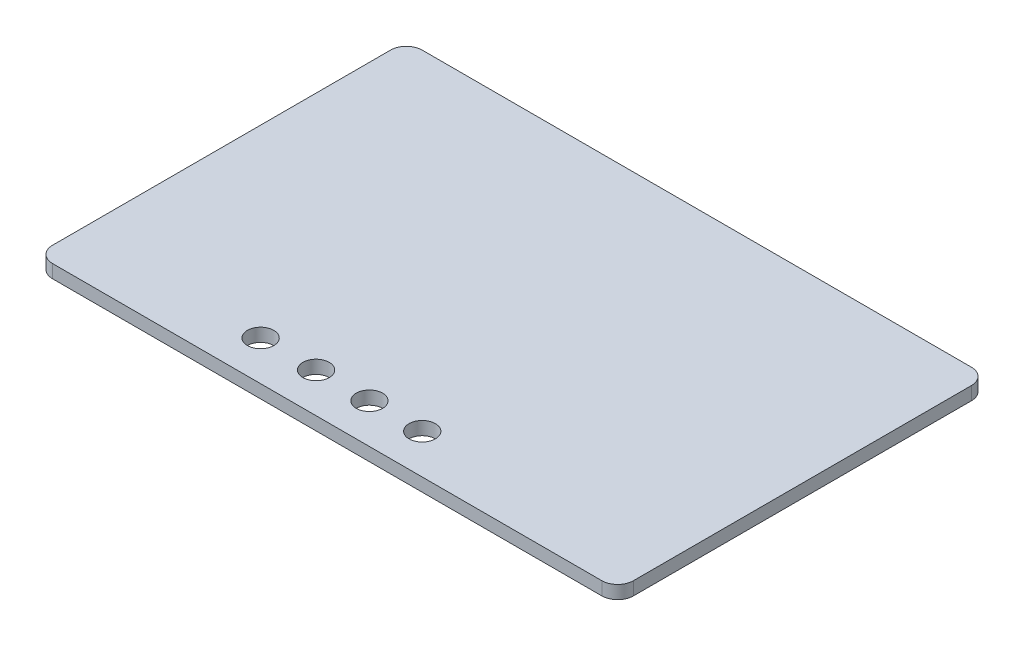
from build123d import *

# Parameters (mm, degrees)
BOSS_EXTRUDE1_DEPTH  = 2.5
BOSS_EXTRUDE6_DEPTH  = 24.5
CUT_EXTRUDE7_REACH   = 72.562
SKETCH3_R            = 2.5
BOSS_EXTRUDE11_START = -24.5
SKETCH12_R           = 1.4
BOSS_EXTRUDE11_DEPTH = 20
CUT_EXTRUDE11_REACH  = 120.55
SKETCH13_R           = 6.15
BOSS_EXTRUDE13_START = -4.5
SKETCH12_5_R         = 1.4
BOSS_EXTRUDE13_DEPTH = 2
CUT_EXTRUDE12_START  = -24.5
CUT_EXTRUDE12_DEPTH  = 24.5
BOSS_EXTRUDE14_START = -24.5
SKETCH12_6_R         = 1.4
BOSS_EXTRUDE14_DEPTH = 5


with BuildPart() as part:
    # Sketch1 → Boss-Extrude1 (new body)
    with BuildSketch(Plane(origin=(0, 0, 0), x_dir=(1, 0, 0), z_dir=(0, 1, 0))):
        with BuildLine():
            Line((-52, -35), (52, -35))
            ThreePointArc((52, -35), (54.121320344, -34.121320344), (55, -32))
            Line((55, -32), (55, 32))
            ThreePointArc((55, 32), (54.121320344, 34.121320344), (52, 35))
            Line((52, 35), (-52, 35))
            ThreePointArc((-52, 35), (-54.121320344, 34.121320344), (-55, 32))
            Line((-55, 32), (-55, -32))
            ThreePointArc((-55, -32), (-54.121320344, -34.121320344), (-52, -35))
        make_face()
    extrude(amount=-BOSS_EXTRUDE1_DEPTH)

    # Sketch7 → Boss-Extrude6 (add)
    with BuildSketch(Plane.XZ.offset(2.5)):
        with BuildLine():
            Line((-55, 32), (-55, -32))
            ThreePointArc((-55, -32), (-54.121320344, -34.121320344), (-52, -35))
            Line((-52, -35), (52, -35))
            ThreePointArc((52, -35), (54.121320344, -34.121320344), (55, -32))
            Line((55, -32), (55, 32))
            ThreePointArc((55, 32), (54.121320344, 34.121320344), (52, 35))
            Line((52, 35), (-52, 35))
            ThreePointArc((-52, 35), (-54.121320344, 34.121320344), (-55, 32))
        make_face()
        with BuildLine():
            Line((-53.5, 32), (-53.5, -32))
            ThreePointArc((-53.5, -32), (-53.060660172, -33.060660172), (-52, -33.5))
            Line((-52, -33.5), (52, -33.5))
            ThreePointArc((52, -33.5), (53.060660172, -33.060660172), (53.5, -32))
            Line((53.5, -32), (53.5, 32))
            ThreePointArc((53.5, 32), (53.060660172, 33.060660172), (52, 33.5))
            Line((52, 33.5), (-52, 33.5))
            ThreePointArc((-52, 33.5), (-53.060660172, 33.060660172), (-53.5, 32))
        make_face(mode=Mode.SUBTRACT)
    extrude(amount=BOSS_EXTRUDE6_DEPTH)

    # Sketch3 → Cut-Extrude7 (cut, up to next)
    with BuildSketch(Plane(origin=(0, 0, 0), x_dir=(1, 0, 0), z_dir=(0, 1, 0)), mode=Mode.PRIVATE) as cut_extrude7_sk1:
        with Locations(Location((-20.1, -27.5, 0), (0, 0, 270))):
            Circle(SKETCH3_R)
    cut_extrude7_tool1 = extrude(cut_extrude7_sk1.sketch, amount=-CUT_EXTRUDE7_REACH, mode=Mode.PRIVATE) & part.part
    # Sketch3 → Cut-Extrude7 (cut, up to next)
    with BuildSketch(Plane(origin=(0, 0, 0), x_dir=(1, 0, 0), z_dir=(0, 1, 0)), mode=Mode.PRIVATE) as cut_extrude7_sk2:
        with Locations(Location((-9.6, -27.5, 0), (0, 0, 270))):
            Circle(SKETCH3_R)
    cut_extrude7_tool2 = extrude(cut_extrude7_sk2.sketch, amount=-CUT_EXTRUDE7_REACH, mode=Mode.PRIVATE) & part.part
    # Sketch3 → Cut-Extrude7 (cut, up to next)
    with BuildSketch(Plane(origin=(0, 0, 0), x_dir=(1, 0, 0), z_dir=(0, 1, 0)), mode=Mode.PRIVATE) as cut_extrude7_sk3:
        with Locations(Location((0.5, -27.5, 0), (0, 0, 270))):
            Circle(SKETCH3_R)
    cut_extrude7_tool3 = extrude(cut_extrude7_sk3.sketch, amount=-CUT_EXTRUDE7_REACH, mode=Mode.PRIVATE) & part.part
    # Sketch3 → Cut-Extrude7 (cut, up to next)
    with BuildSketch(Plane(origin=(0, 0, 0), x_dir=(1, 0, 0), z_dir=(0, 1, 0)), mode=Mode.PRIVATE) as cut_extrude7_sk4:
        with Locations(Location((10.5, -27.5, 0), (0, 0, 270))):
            Circle(SKETCH3_R)
    cut_extrude7_tool4 = extrude(cut_extrude7_sk4.sketch, amount=-CUT_EXTRUDE7_REACH, mode=Mode.PRIVATE) & part.part
    add(cut_extrude7_tool1.solids().sort_by_distance((-20.1, 0, 27.5))[0], mode=Mode.SUBTRACT)
    add(cut_extrude7_tool2.solids().sort_by_distance((-9.6, 0, 27.5))[0], mode=Mode.SUBTRACT)
    add(cut_extrude7_tool3.solids().sort_by_distance((0.5, 0, 27.5))[0], mode=Mode.SUBTRACT)
    add(cut_extrude7_tool4.solids().sort_by_distance((10.5, 0, 27.5))[0], mode=Mode.SUBTRACT)

    # Sketch12 → Boss-Extrude11 (add)
    # profile 1 of 6: a face of its own
    with BuildSketch(Plane.XZ.offset(27).offset(BOSS_EXTRUDE11_START)):
        with BuildLine():
            Line((-39.5, 27.5), (-39.5, 33.5))
            Line((-39.5, 33.5), (-52, 33.5))
            ThreePointArc((-52, 33.5), (-53.060660172, 33.060660172), (-53.5, 32))
            Line((-53.5, 32), (-53.5, 22.5))
            Line((-53.5, 22.5), (-44.5, 22.5))
            ThreePointArc((-44.5, 22.5), (-40.964466094, 23.964466094), (-39.5, 27.5))
        make_face()
        with Locations(Location((-45.5, 27.5, 0), (0, 0, 270))):
            Circle(SKETCH12_R, mode=Mode.SUBTRACT)
    # profile 2 of 6: a face of its own
    with BuildSketch(Plane.XZ.offset(27).offset(BOSS_EXTRUDE11_START)):
        with BuildLine():
            Line((29.5, 33.5), (18.5, 33.5))
            Line((18.5, 33.5), (18.5, 27.5))
            ThreePointArc((18.5, 27.5), (19.964466094, 23.964466094), (23.5, 22.5))
            Line((23.5, 22.5), (24.5, 22.5))
            ThreePointArc((24.5, 22.5), (28.035533906, 23.964466094), (29.5, 27.5))
            Line((29.5, 27.5), (29.5, 33.5))
        make_face()
        with Locations(Location((24.5, 27.5, 0), (0, 0, 270))):
            Circle(SKETCH12_R, mode=Mode.SUBTRACT)
    # profile 3 of 6: a face of its own
    with BuildSketch(Plane.XZ.offset(27).offset(BOSS_EXTRUDE11_START)):
        with BuildLine():
            Line((18.5, -27.5), (18.5, -33.5))
            Line((18.5, -33.5), (29.5, -33.5))
            Line((29.5, -33.5), (29.5, -27.5))
            ThreePointArc((29.5, -27.5), (28.035533906, -23.964466094), (24.5, -22.5))
            Line((24.5, -22.5), (23.5, -22.5))
            ThreePointArc((23.5, -22.5), (19.964466094, -23.964466094), (18.5, -27.5))
        make_face()
        with Locations(Location((24.5, -27.5, 0), (0, 0, 270))):
            Circle(SKETCH12_R, mode=Mode.SUBTRACT)
    # profile 4 of 6: a face of its own
    with BuildSketch(Plane.XZ.offset(27).offset(BOSS_EXTRUDE11_START)):
        with BuildLine():
            Line((-44.5, -22.5), (-53.5, -22.5))
            Line((-53.5, -22.5), (-53.5, -32))
            ThreePointArc((-53.5, -32), (-53.060660172, -33.060660172), (-52, -33.5))
            Line((-52, -33.5), (-39.5, -33.5))
            Line((-39.5, -33.5), (-39.5, -27.5))
            ThreePointArc((-39.5, -27.5), (-40.964466094, -23.964466094), (-44.5, -22.5))
        make_face()
        with Locations(Location((-45.5, -27.5, 0), (0, 0, 270))):
            Circle(SKETCH12_R, mode=Mode.SUBTRACT)
    # profile 5 of 6: a face of its own
    with BuildSketch(Plane.XZ.offset(27).offset(BOSS_EXTRUDE11_START)):
        with BuildLine():
            Line((52, 33.5), (39.5, 33.5))
            Line((39.5, 33.5), (39.5, 27.5))
            ThreePointArc((39.5, 27.5), (40.964466094, 23.964466094), (44.5, 22.5))
            Line((44.5, 22.5), (53.5, 22.5))
            Line((53.5, 22.5), (53.5, 32))
            ThreePointArc((53.5, 32), (53.060660172, 33.060660172), (52, 33.5))
        make_face()
        with Locations(Location((45.5, 27.5, 0), (0, 0, 270))):
            Circle(SKETCH12_R, mode=Mode.SUBTRACT)
    # profile 6 of 6: a face of its own
    with BuildSketch(Plane.XZ.offset(27).offset(BOSS_EXTRUDE11_START)):
        with BuildLine():
            Line((53.5, -32), (53.5, -22.5))
            Line((53.5, -22.5), (44.5, -22.5))
            ThreePointArc((44.5, -22.5), (40.964466094, -23.964466094), (39.5, -27.5))
            Line((39.5, -27.5), (39.5, -33.5))
            Line((39.5, -33.5), (52, -33.5))
            ThreePointArc((52, -33.5), (53.060660172, -33.060660172), (53.5, -32))
        make_face()
        with Locations(Location((45.5, -27.5, 0), (0, 0, 270))):
            Circle(SKETCH12_R, mode=Mode.SUBTRACT)
    extrude(amount=BOSS_EXTRUDE11_DEPTH)

    # Sketch13 → Cut-Extrude11 (cut, up to next)
    with BuildSketch(Plane(origin=(55, 0, 0), x_dir=(0, 0, -1), z_dir=(1, 0, 0)), mode=Mode.PRIVATE) as cut_extrude11_sk1:
        with Locations((-12, -17)):
            Circle(SKETCH13_R)
    cut_extrude11_tool1 = extrude(cut_extrude11_sk1.sketch, amount=-CUT_EXTRUDE11_REACH, mode=Mode.PRIVATE) & part.part
    add(cut_extrude11_tool1.solids().sort_by_distance((55, -17, 12))[0], mode=Mode.SUBTRACT)

    # Sketch12<5> → Boss-Extrude13 (add)
    # profile 1 of 2: a face of its own
    with BuildSketch(Plane.XZ.offset(27).offset(BOSS_EXTRUDE13_START)):
        with BuildLine():
            Line((44.5, 22.5), (53.5, 22.5))
            Line((53.5, 22.5), (53.5, 32))
            ThreePointArc((53.5, 32), (53.060660172, 33.060660172), (52, 33.5))
            Line((52, 33.5), (39.5, 33.5))
            Line((39.5, 33.5), (39.5, 27.5))
            ThreePointArc((39.5, 27.5), (40.964466094, 23.964466094), (44.5, 22.5))
        make_face()
        with Locations(Location((45.5, 27.5, 0), (0, 0, 270))):
            Circle(SKETCH12_5_R, mode=Mode.SUBTRACT)
    # profile 2 of 2: a face of its own
    with BuildSketch(Plane.XZ.offset(27).offset(BOSS_EXTRUDE13_START)):
        with BuildLine():
            Line((39.5, -27.5), (39.5, -33.5))
            Line((39.5, -33.5), (52, -33.5))
            ThreePointArc((52, -33.5), (53.060660172, -33.060660172), (53.5, -32))
            Line((53.5, -32), (53.5, -22.5))
            Line((53.5, -22.5), (44.5, -22.5))
            ThreePointArc((44.5, -22.5), (40.964466094, -23.964466094), (39.5, -27.5))
        make_face()
        with Locations(Location((45.5, -27.5, 0), (0, 0, 270))):
            Circle(SKETCH12_5_R, mode=Mode.SUBTRACT)
    extrude(amount=BOSS_EXTRUDE13_DEPTH)

    # Sketch14 → Cut-Extrude12 (cut)
    with BuildSketch(Plane.XZ.offset(27).offset(CUT_EXTRUDE12_START)):
        with BuildLine():
            Line((-55, 32), (-55, -32))
            ThreePointArc((-55, -32), (-54.121320344, -34.121320344), (-52, -35))
            Line((-52, -35), (52, -35))
            ThreePointArc((52, -35), (54.121320344, -34.121320344), (55, -32))
            Line((55, -32), (55, 32))
            ThreePointArc((55, 32), (54.121320344, 34.121320344), (52, 35))
            Line((52, 35), (-52, 35))
            ThreePointArc((-52, 35), (-54.121320344, 34.121320344), (-55, 32))
        make_face()
    extrude(amount=CUT_EXTRUDE12_DEPTH, mode=Mode.SUBTRACT)

    # Sketch12<6> → Boss-Extrude14 (add)
    with BuildSketch(Plane.XZ.offset(27).offset(BOSS_EXTRUDE14_START)):
        with Locations(Location((-45.5, 27.5, 0), (0, 0, 270))):
            Circle(SKETCH12_6_R)
        with Locations(Location((-45.5, -27.5, 0), (0, 0, 270))):
            Circle(SKETCH12_6_R)
        with Locations(Location((24.5, -27.5, 0), (0, 0, 270))):
            Circle(SKETCH12_6_R)
        with Locations(Location((45.5, -27.5, 0), (0, 0, 270))):
            Circle(SKETCH12_6_R)
        with Locations(Location((45.5, 27.5, 0), (0, 0, 270))):
            Circle(SKETCH12_6_R)
        with Locations(Location((24.5, 27.5, 0), (0, 0, 270))):
            Circle(SKETCH12_6_R)
    extrude(amount=BOSS_EXTRUDE14_DEPTH)


solid = part.part
